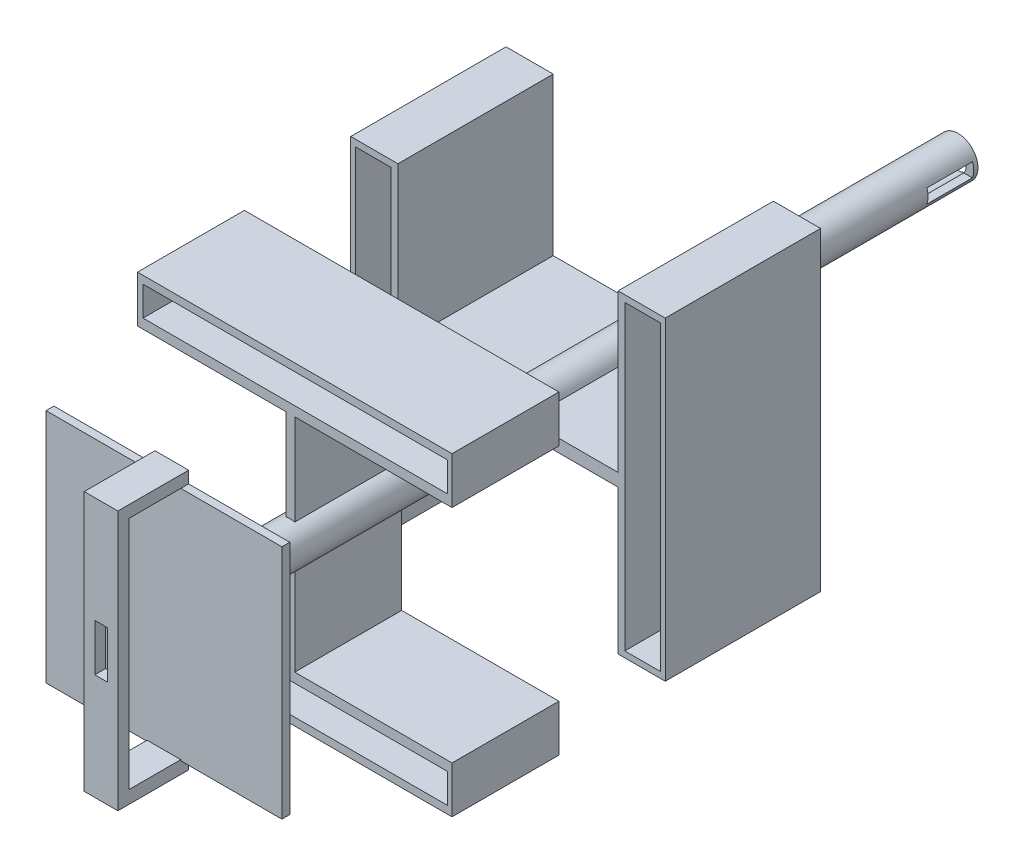
from build123d import *

# Parameters (mm, degrees)
BOSS_EXTRUDE1_DEPTH      = 175
BOSS_EXTRUDE1_DEPTH_BACK = 325
SKETCH1_R                = 12.637842641
BOSS_EXTRUDE2_DEPTH      = 100
BOSS_EXTRUDE2_DEPTH_BACK = 100
SKETCH2_W                = 5.637667912
SKETCH2_H                = 67.983642473
BOSS_EXTRUDE3_DEPTH      = 100
BOSS_EXTRUDE3_DEPTH_BACK = 100
SKETCH3_W                = 67.983642473
SKETCH3_H                = 29.694964858
SKETCH4_W                = 193.517193279
SKETCH4_H                = 18.701241368
CUT_EXTRUDE1_DEPTH       = 63
BOSS_EXTRUDE4_DEPTH      = 100
BOSS_EXTRUDE4_DEPTH_BACK = 100
SKETCH5_W                = 98.759478103
SKETCH5_H                = 8.09947515
BOSS_EXTRUDE5_DEPTH      = 100
BOSS_EXTRUDE5_DEPTH_BACK = 100
SKETCH6_W                = 30
SKETCH6_H                = 98.759478103
SKETCH7_W                = 22.635129566
SKETCH7_H                = 191.944809052
CUT_EXTRUDE2_DEPTH       = 86
SKETCH8_W                = 150
SKETCH8_H                = 150
BOSS_EXTRUDE6_DEPTH      = 5
BOSS_EXTRUDE7_REACH      = 566.29
SKETCH10_W               = 21.396607864
SKETCH10_H               = 165.105210234
SKETCH11_W               = 33.062075252
SKETCH11_H               = 149.372216897
CUT_EXTRUDE3_DEPTH       = 40
SKETCH12_W               = 8
SKETCH12_H               = 30
CUT_EXTRUDE4_DEPTH       = 30
SKETCH13_R               = 7.843556452
CUT_EXTRUDE5_DEPTH       = 141
SKETCH14_W               = 29
SKETCH14_H               = 9
CUT_EXTRUDE6_DEPTH       = 141
SKETCH15_W               = 29
SKETCH15_H               = 9
CUT_EXTRUDE7_DEPTH       = 83


with BuildPart() as part:
    # Sketch1 → Boss-Extrude1 (new, two sides: drawn at the far end of the back side and taken through both)
    with BuildSketch(Plane.XY.offset(-BOSS_EXTRUDE1_DEPTH_BACK)):
        Circle(SKETCH1_R)
    extrude(amount=BOSS_EXTRUDE1_DEPTH + BOSS_EXTRUDE1_DEPTH_BACK)

    # Sketch2 → Boss-Extrude2 (add, two sides: drawn at the far end of the back side and taken through both)
    with BuildSketch(Plane(origin=(0, 0, 0), x_dir=(1, 0, 0), z_dir=(0, 1, 0)).offset(-BOSS_EXTRUDE2_DEPTH_BACK)):
        with Locations((0, -65.65046148)):
            Rectangle(SKETCH2_W, SKETCH2_H)
    extrude(amount=BOSS_EXTRUDE2_DEPTH + BOSS_EXTRUDE2_DEPTH_BACK)

    # Sketch3 → Boss-Extrude3 (add, two sides: drawn at the far end of the back side and taken through both)
    with BuildSketch(Plane(origin=(2.818833956, 0, 0), x_dir=(0, 0, -1), z_dir=(1, 0, 0)).offset(-BOSS_EXTRUDE3_DEPTH_BACK)):
        with Locations((-65.65046148, 85.152517571)):
            Rectangle(SKETCH3_W, SKETCH3_H)
        with Locations((-65.65046148, -85.152517571)):
            Rectangle(SKETCH3_W, SKETCH3_H)
    extrude(amount=BOSS_EXTRUDE3_DEPTH + BOSS_EXTRUDE3_DEPTH_BACK)

    # Sketch4 → Cut-Extrude1 (cut)
    with BuildSketch(Plane.XY.offset(99.642282717)):
        with Locations((3.08986644, 85.773498781)):
            Rectangle(SKETCH4_W, SKETCH4_H)
        with Locations((3.08986644, -85.773498781)):
            Rectangle(SKETCH4_W, SKETCH4_H)
    extrude(amount=-CUT_EXTRUDE1_DEPTH, mode=Mode.SUBTRACT)

    # Sketch5 → Boss-Extrude4 (add, two sides: drawn at the far end of the back side and taken through both)
    with BuildSketch(Plane(origin=(0, 0, 0), x_dir=(0, 0, -1), z_dir=(1, 0, 0)).offset(-BOSS_EXTRUDE4_DEPTH_BACK)):
        with Locations((88.14712325, 0)):
            Rectangle(SKETCH5_W, SKETCH5_H)
    extrude(amount=BOSS_EXTRUDE4_DEPTH + BOSS_EXTRUDE4_DEPTH_BACK)

    # Sketch6 → Boss-Extrude5 (add, two sides: drawn at the far end of the back side and taken through both)
    with BuildSketch(Plane(origin=(0, 4.049737575, 0), x_dir=(1, 0, 0), z_dir=(0, 1, 0)).offset(-BOSS_EXTRUDE5_DEPTH_BACK)):
        with Locations((-85, 88.14712325)):
            Rectangle(SKETCH6_W, SKETCH6_H)
        with Locations((85, 88.14712325)):
            Rectangle(SKETCH6_W, SKETCH6_H)
    extrude(amount=BOSS_EXTRUDE5_DEPTH + BOSS_EXTRUDE5_DEPTH_BACK)

    # Sketch7 → Cut-Extrude2 (cut)
    with BuildSketch(Plane.XY.offset(-38.767384198)):
        with Locations((-85.588690937, 3.879977002)):
            Rectangle(SKETCH7_W, SKETCH7_H)
        with Locations((85.588690937, 3.879977002)):
            Rectangle(SKETCH7_W, SKETCH7_H)
    extrude(amount=-CUT_EXTRUDE2_DEPTH, mode=Mode.SUBTRACT)

    # Sketch8 → Boss-Extrude6 (add)
    with BuildSketch(Plane.XY.offset(175)):
        Rectangle(SKETCH8_W, SKETCH8_H)
    extrude(amount=BOSS_EXTRUDE6_DEPTH)

    # Boss-Extrude7: up to this face of the body (flat: up to its plane)
    boss_extrude7_end = Plane(part.part.faces().sort_by_distance((0, -72.878679656, 175))[0])
    # Sketch10 → Boss-Extrude7 (add, up to the picked face)
    with BuildSketch(Plane.XY.offset(220), mode=Mode.PRIVATE) as boss_extrude7_sk1:
        Rectangle(SKETCH10_W, SKETCH10_H)
    boss_extrude7_tool1 = split(extrude(boss_extrude7_sk1.sketch, amount=-BOSS_EXTRUDE7_REACH, mode=Mode.PRIVATE), bisect_by=boss_extrude7_end, keep=Keep.BOTH, mode=Mode.PRIVATE)
    add(boss_extrude7_tool1.solids().sort_by(Axis((0, 0, 220), (0, 0, -1)))[0])

    # Sketch11 → Cut-Extrude3 (cut)
    with BuildSketch(Plane.ZY.offset(10.698303932)):
        with Locations((196.531037626, 0.313891551)):
            Rectangle(SKETCH11_W, SKETCH11_H)
    extrude(amount=-CUT_EXTRUDE3_DEPTH, mode=Mode.SUBTRACT)

    # Sketch12 → Cut-Extrude4 (cut)
    with BuildSketch(Plane.XY.offset(220)):
        Rectangle(SKETCH12_W, SKETCH12_H)
    extrude(amount=-CUT_EXTRUDE4_DEPTH, mode=Mode.SUBTRACT)

    # Sketch13 → Cut-Extrude5 (cut)
    with BuildSketch(Plane(origin=(0, 0, -325), x_dir=(-1, 0, 0), z_dir=(0, 0, -1))):
        Circle(SKETCH13_R)
    extrude(amount=-CUT_EXTRUDE5_DEPTH, mode=Mode.SUBTRACT)

    # Sketch14 → Cut-Extrude6 (cut)
    with BuildSketch(Plane.ZY):
        with Locations((-307.774546231, -0.108379214)):
            Rectangle(SKETCH14_W, SKETCH14_H)
    extrude(amount=-CUT_EXTRUDE6_DEPTH, mode=Mode.SUBTRACT)

    # Sketch15 → Cut-Extrude7 (cut)
    with BuildSketch(Plane.ZY):
        with Locations((-274.519862271, -0.063837762)):
            Rectangle(SKETCH15_W, SKETCH15_H)
    extrude(amount=CUT_EXTRUDE7_DEPTH, mode=Mode.SUBTRACT)


solid = part.part
